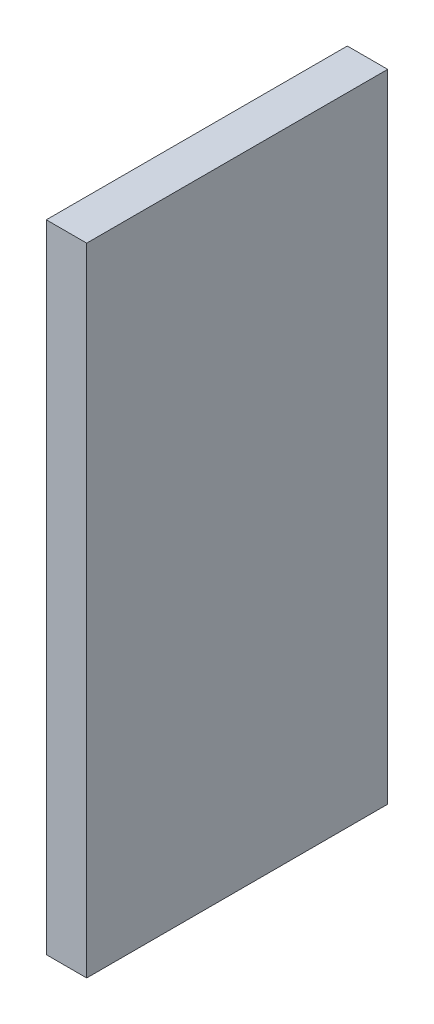
from build123d import *

# Parameters (mm, degrees)
SKETCH1_W           = 47.3
SKETCH1_H           = 100
BOSS_EXTRUDE1_DEPTH = 6.35


with BuildPart() as part:
    # Sketch1 → Boss-Extrude1 (new body)
    with BuildSketch(Plane(origin=(0, 0, 0), x_dir=(0, 0, -1), z_dir=(1, 0, 0))):
        with Locations((23.65, 50)):
            Rectangle(SKETCH1_W, SKETCH1_H)
    extrude(amount=BOSS_EXTRUDE1_DEPTH)


solid = part.part
